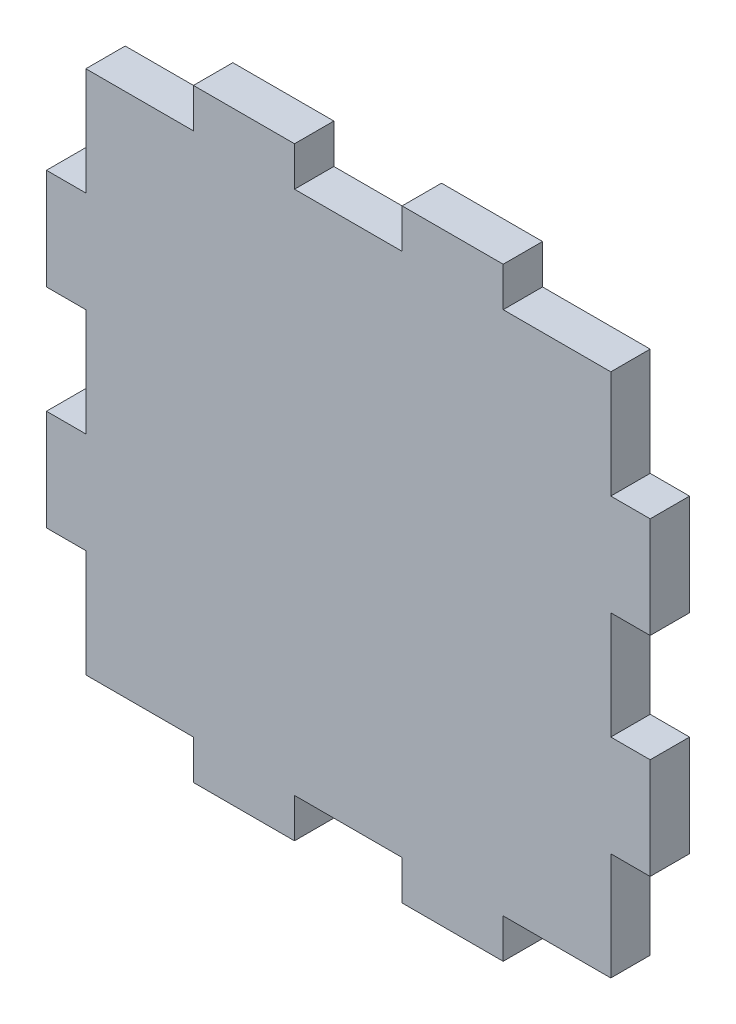
from build123d import *

# Parameters (mm, degrees)
CROQUIS1_W              = 3
CROQUIS1_H              = 7.7
CROQUIS1_W_2            = 7.7
CROQUIS1_H_2            = 3
CROQUIS1_W_3            = 40
CROQUIS1_H_3            = 40
SALIENTE_EXTRUIR1_DEPTH = 3


with BuildPart() as part:
    # Croquis1 → Saliente-Extruir1 (new body)
    with BuildSketch(Plane.XY):
        with Locations((-21.5, -7.95)):
            Rectangle(CROQUIS1_W, CROQUIS1_H)
        with Locations((-7.95, -21.5)):
            Rectangle(CROQUIS1_W_2, CROQUIS1_H_2)
        with Locations((7.95, -21.5)):
            Rectangle(CROQUIS1_W_2, CROQUIS1_H_2)
        with Locations((21.5, -7.95)):
            Rectangle(CROQUIS1_W, CROQUIS1_H)
        with Locations((21.5, 7.95)):
            Rectangle(CROQUIS1_W, CROQUIS1_H)
        with Locations((-21.5, 7.95)):
            Rectangle(CROQUIS1_W, CROQUIS1_H)
        with Locations((-7.95, 21.5)):
            Rectangle(CROQUIS1_W_2, CROQUIS1_H_2)
        with Locations((7.95, 21.5)):
            Rectangle(CROQUIS1_W_2, CROQUIS1_H_2)
        Rectangle(CROQUIS1_W_3, CROQUIS1_H_3)
    extrude(amount=SALIENTE_EXTRUIR1_DEPTH)


solid = part.part
